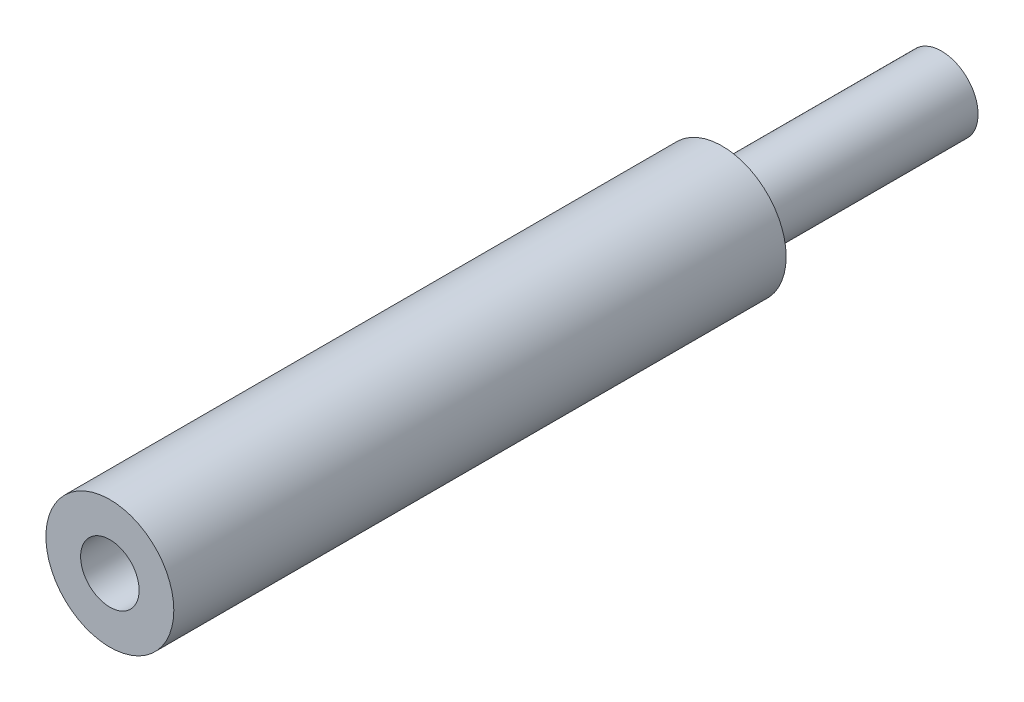
from build123d import *

# Parameters (mm, degrees)
SKETCH1_R                   = 3.5
BOSS_EXTRUDE1_DEPTH         = 33.5
SKETCH2_R                   = 2
BOSS_EXTRUDE2_DEPTH         = 12
TAP_DRILL_FOR_M3_TAP1_D     = 3.2
TAP_DRILL_FOR_M3_TAP1_DEPTH = 14
TAP_DRILL_FOR_M3_TAP1_TIP   = 0.96137699


with BuildPart() as part:
    # Sketch1 → Boss-Extrude1 (new body)
    with BuildSketch(Plane.XY):
        Circle(SKETCH1_R)
    extrude(amount=BOSS_EXTRUDE1_DEPTH)

    # Sketch2 → Boss-Extrude2 (add)
    with BuildSketch(Plane(origin=(0, 0, 0), x_dir=(-1, 0, 0), z_dir=(0, 0, -1))):
        Circle(SKETCH2_R)
    extrude(amount=BOSS_EXTRUDE2_DEPTH)

    # Tap Drill for M3 Tap1
    with Locations(Plane.XY.offset(33.5)):
        with Locations((0, 0)):
            Hole(TAP_DRILL_FOR_M3_TAP1_D / 2, depth=TAP_DRILL_FOR_M3_TAP1_DEPTH)
            with Locations((0, 0, -(TAP_DRILL_FOR_M3_TAP1_DEPTH + TAP_DRILL_FOR_M3_TAP1_TIP / 2))):  # 118° drill point
                Cone(0, TAP_DRILL_FOR_M3_TAP1_D / 2, TAP_DRILL_FOR_M3_TAP1_TIP, mode=Mode.SUBTRACT)


solid = part.part
